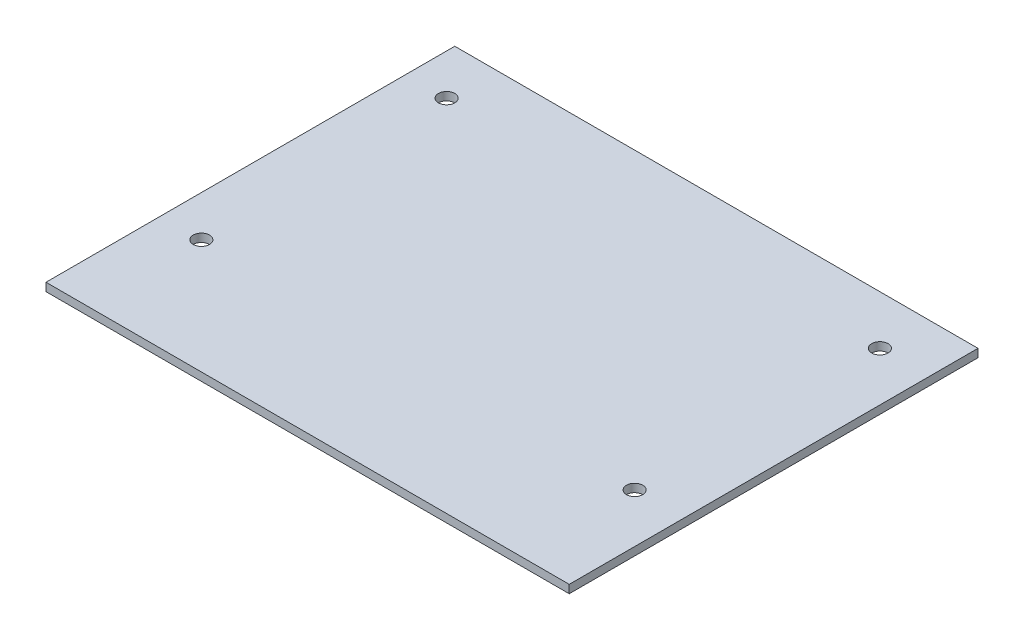
from build123d import *

# Parameters (mm, degrees)
SKETCH1_W                      = 406.4
SKETCH1_H                      = 317.5
BOSS_EXTRUDE1_DEPTH            = 6.35
F_1_2_0_5_DIAMETER_HOLE1_D     = 12.7
F_1_2_0_5_DIAMETER_HOLE1_DEPTH = 12.7
F_1_2_0_5_DIAMETER_HOLE1_TIP   = 3.815464931


with BuildPart() as part:
    # Sketch1 → Boss-Extrude1 (new body)
    with BuildSketch(Plane(origin=(0, 0, 0), x_dir=(1, 0, 0), z_dir=(0, 1, 0))):
        Rectangle(SKETCH1_W, SKETCH1_H)
    extrude(amount=BOSS_EXTRUDE1_DEPTH)

    # 1/2 (0.5) Diameter Hole1
    with Locations(Plane(origin=(0, 6.35, 0), x_dir=(1, 0, 0), z_dir=(0, 1, 0))):
        with Locations((-171.45, 120.65), (165.1, 120.65), (165.1, -69.85), (-171.45, -69.85)):
            Hole(F_1_2_0_5_DIAMETER_HOLE1_D / 2, depth=F_1_2_0_5_DIAMETER_HOLE1_DEPTH)
            with Locations((0, 0, -(F_1_2_0_5_DIAMETER_HOLE1_DEPTH + F_1_2_0_5_DIAMETER_HOLE1_TIP / 2))):  # 118° drill point
                Cone(0, F_1_2_0_5_DIAMETER_HOLE1_D / 2, F_1_2_0_5_DIAMETER_HOLE1_TIP, mode=Mode.SUBTRACT)


solid = part.part
